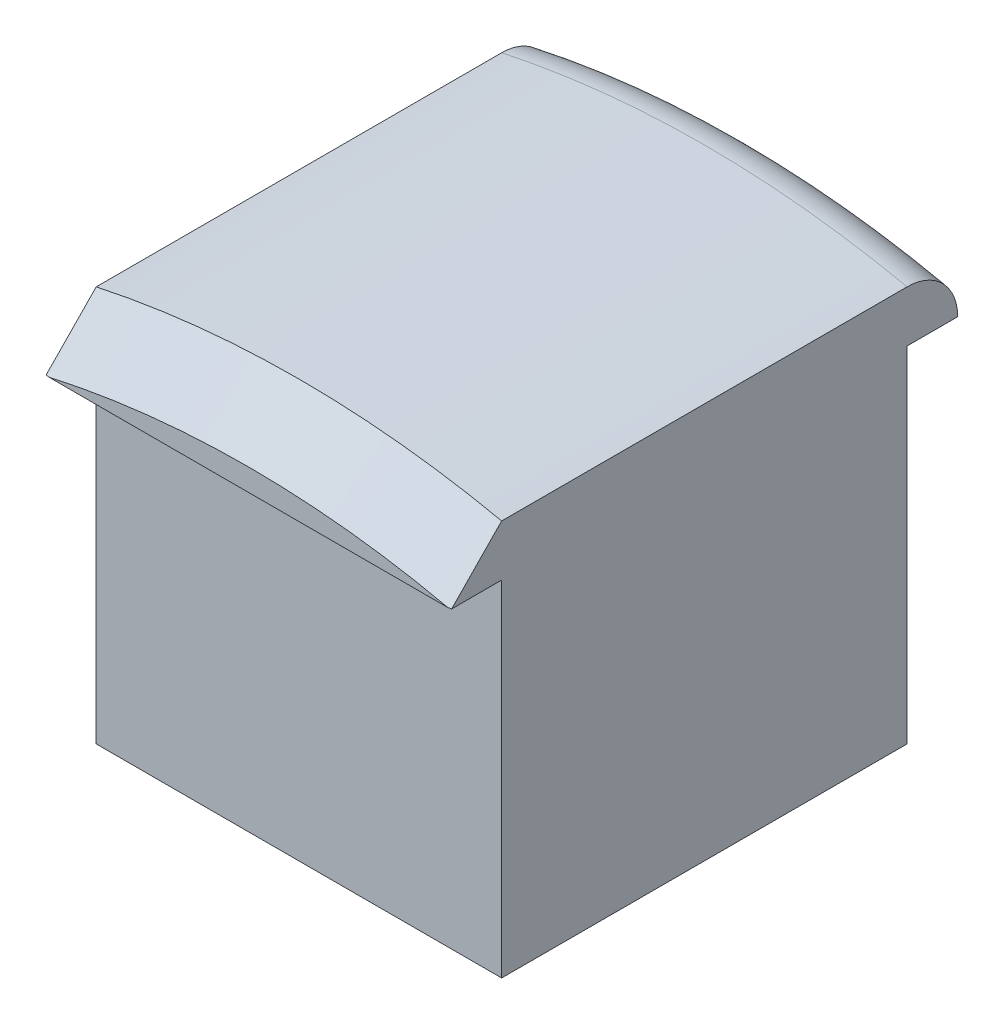
from build123d import *

# Parameters (mm, degrees)
SALIENTE_EXTRUIR1_DEPTH = 50
CROQUIS4_W              = 5
CROQUIS4_H              = 34
CORTAR_EXTRUIR3_DEPTH   = 50
CROQUIS5_W              = 36
CROQUIS5_H              = 32
CORTAR_EXTRUIR4_DEPTH   = 38
REDONDEO1_R             = 5
CHAFL_N1_SIZE           = 5


with BuildPart() as part:
    # Croquis1 → Saliente-Extruir1 (new body)
    with BuildSketch(Plane.XY):
        with BuildLine():
            Line((-50.7945892, 115.897083669), (-50.7945892, 110.077719464))
            Line((-50.7945892, 110.077719464), (-50.7945892, 76.846205564))
            Line((-50.7945892, 76.846205564), (-10.7945892, 76.846205564))
            Line((-10.7945892, 76.846205564), (-10.7945892, 110.077719464))
            Line((-10.7945892, 110.077719464), (-10.7945892, 115.897083669))
            ThreePointArc((-10.7945892, 115.897083669), (-30.7945892, 118.026205564), (-50.7945892, 115.897083669))
        make_face()
    extrude(amount=SALIENTE_EXTRUIR1_DEPTH)

    # Croquis4 → Cortar-Extruir3 (cut)
    with BuildSketch(Plane.ZY.offset(50.7945892)):
        with Locations((2.5, 93.846205564)):
            Rectangle(CROQUIS4_W, CROQUIS4_H)
        with Locations((47.5, 93.846205564)):
            Rectangle(CROQUIS4_W, CROQUIS4_H)
    extrude(amount=-CORTAR_EXTRUIR3_DEPTH, mode=Mode.SUBTRACT)

    # Croquis5 → Cortar-Extruir4 (cut)
    with BuildSketch(Plane(origin=(0, 0, 5), x_dir=(-1, 0, 0), z_dir=(0, 0, -1))):
        with Locations((30.7945892, 94.846205564)):
            Rectangle(CROQUIS5_W, CROQUIS5_H)
    extrude(amount=-CORTAR_EXTRUIR4_DEPTH, mode=Mode.SUBTRACT)

    # Redondeo1
    redondeo1_edges = [part.edges().sort_by_distance(p)[0] for p in [
        (-30.7945892, 118.026205564, 0),
    ]]
    fillet(redondeo1_edges, radius=REDONDEO1_R)

    # Chaflán1
    chafl_n1_edges = [part.edges().sort_by_distance(p)[0] for p in [
        (-30.7945892, 118.026205564, 50),
    ]]
    chamfer(chafl_n1_edges, length=CHAFL_N1_SIZE)


solid = part.part
